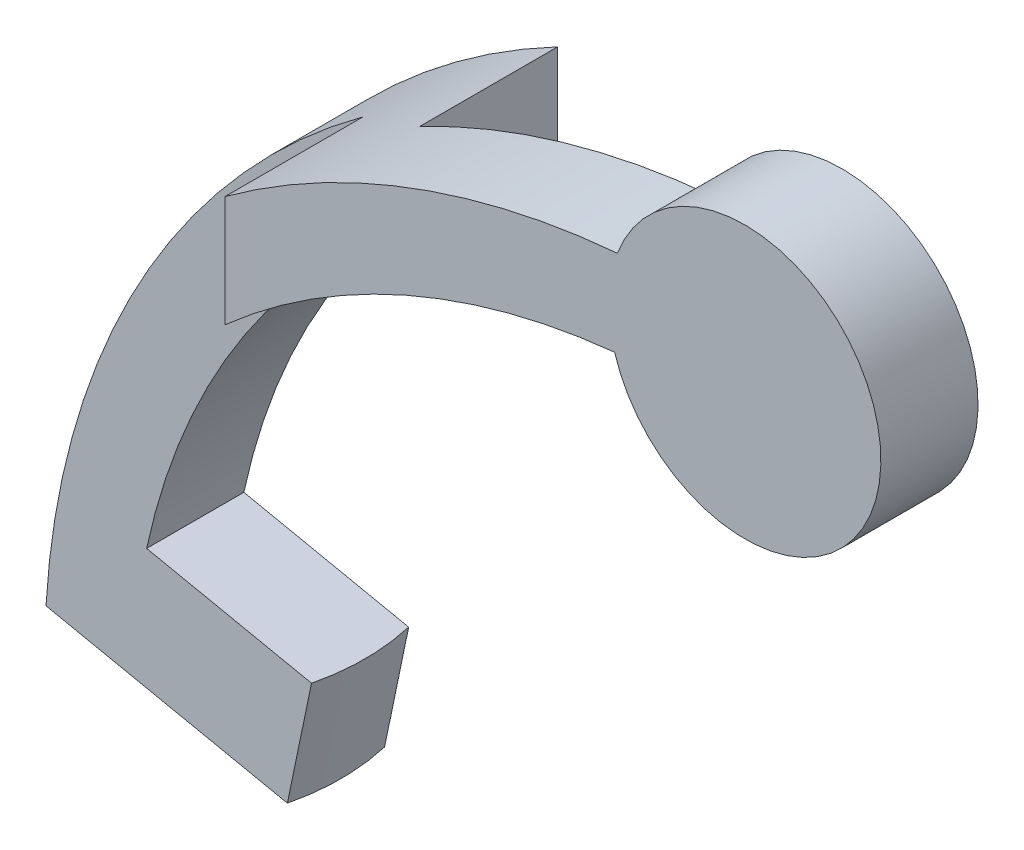
from build123d import *

# Parameters (mm, degrees)
BOSS_EXTRU_2_DEPTH      = 5
BOSS_EXTRU_3_DEPTH      = 45
ENL_V_START             = -73.880031702
ENL_V_MAT_EXTRU_3_DEPTH = 78.880031702
ESQUISSE4_4_W           = 16.307493561
ESQUISSE4_4_H           = 7.104058167
ENL_V_MAT_EXTRU_4_DEPTH = 59.591870128
ENL_V_MAT_EXTRU_6_DEPTH = 58.24377063
ENL_V_MAT_EXTRU_7_DEPTH = 59.494096558


with BuildPart() as part:
    # Esquisse3 → Boss.-Extru.2 (new body)
    with BuildSketch(Plane.XY):
        with BuildLine():
            ThreePointArc((7, 0), (1.246257582, 6.888166813), (-6.556240583, 2.452694319))
            ThreePointArc((-6.556240583, 2.452694319), (-6.99644453, 0.22307834), (-6.699170831, -2.030051767))
            ThreePointArc((-6.699170831, -2.030051767), (1.026110175, -6.924384298), (7, 0))
        make_face()
    extrude(amount=BOSS_EXTRU_2_DEPTH)

    # Esquisse3<3> → Boss.-Extru.3 (add)
    with BuildSketch(Plane.XY):
        with BuildLine():
            ThreePointArc((-6.556240583, 2.452694319), (-31.795381091, -9.503990443), (-43.059714875, -35.059641647))
            Line((-43.059714875, -35.059641647), (-29.67043681, -37.846531887))
            Line((-29.67043681, -37.846531887), (-28.42882324, -31.881349224))
            Line((-28.42882324, -31.881349224), (-37.880972605, -29.913946449))
            ThreePointArc((-37.880972605, -29.913946449), (-26.825365644, -10.900303142), (-6.699170831, -2.030051767))
            ThreePointArc((-6.699170831, -2.030051767), (-6.99644453, 0.22307834), (-6.556240583, 2.452694319))
        make_face()
    boss_extru_3 = extrude(amount=BOSS_EXTRU_3_DEPTH)

    # Esquisse4 → Enlèv. mat.-Extru.3 (cut)
    with BuildSketch(Plane(origin=(0, 0, 0), x_dir=(1, 0, 0), z_dir=(0, 1, 0)).offset(ENL_V_START)):
        Polygon((-6.556240583, -21.643777245), (-6.556240583, -5), (-21.736227675, -5), (-21.736227675, -12.104058167), (-43.059714875, -12.104058167), (-43.059714875, -45), (-43.059714875, -53.527020644), (-6.425184121, -53.527020644), align=None)
    enl_v_mat_extru_3 = extrude(amount=ENL_V_MAT_EXTRU_3_DEPTH, mode=Mode.SUBTRACT)

    # Esquisse4<4> → Enlèv. mat.-Extru.4 (cut, through all)
    with BuildSketch(Plane(origin=(0, 0, 0), x_dir=(1, 0, 0), z_dir=(0, 1, 0))):
        with Locations((-34.905968095, -3.552029084)):
            Rectangle(ESQUISSE4_4_W, ESQUISSE4_4_H)
    enl_v_mat_extru_4 = extrude(amount=-ENL_V_MAT_EXTRU_4_DEPTH, mode=Mode.SUBTRACT)

    # Esquisse5 → Enlèv. mat.-Extru.6 (cut, through all)
    with BuildSketch(Plane(origin=(-7.540837864, -36.229046112, 0), x_dir=(0.9790175257089632, -0.2037760642340011, 0), z_dir=(0.2037760642340011, 0.9790175257089632, 0))):
        with BuildLine():
            Line((-22.326681436, -7.104058167), (-21.33566032, -7.104058167))
            Line((-21.33566032, -7.104058167), (-21.33566032, -12.104058167))
            Line((-21.33566032, -12.104058167), (-22.326681436, -12.104058167))
            ThreePointArc((-22.326681436, -12.104058167), (-22.079342596, -9.604058167), (-22.326681436, -7.104058167))
        make_face()
    enl_v_mat_extru_6 = extrude(amount=-ENL_V_MAT_EXTRU_6_DEPTH, mode=Mode.SUBTRACT)

    # Symétrie1: Boss.-Extru.3, Enlèv. mat.-Extru.3, Enlèv. mat.-Extru.4, Enlèv. mat.-Extru.6 across plane
    add(boss_extru_3.mirror(Plane.XY.offset(2.5)))
    add(enl_v_mat_extru_3.mirror(Plane.XY.offset(2.5)), mode=Mode.SUBTRACT)
    add(enl_v_mat_extru_4.mirror(Plane.XY.offset(2.5)), mode=Mode.SUBTRACT)
    add(enl_v_mat_extru_6.mirror(Plane.XY.offset(2.5)), mode=Mode.SUBTRACT)

    # Esquisse6 → Enlèv. mat.-Extru.7 (cut, through all)
    with BuildSketch(Plane(origin=(0, 0, 0), x_dir=(1, 0, 0), z_dir=(0, 1, 0))):
        Polygon((-21.736227675, -5), (-29.704410318, -5), (-43.059714875, -7.104058167), (-43.059714875, -12.104058167), (-21.736227675, -12.104058167), align=None)
    extrude(amount=-ENL_V_MAT_EXTRU_7_DEPTH, mode=Mode.SUBTRACT)


solid = part.part
